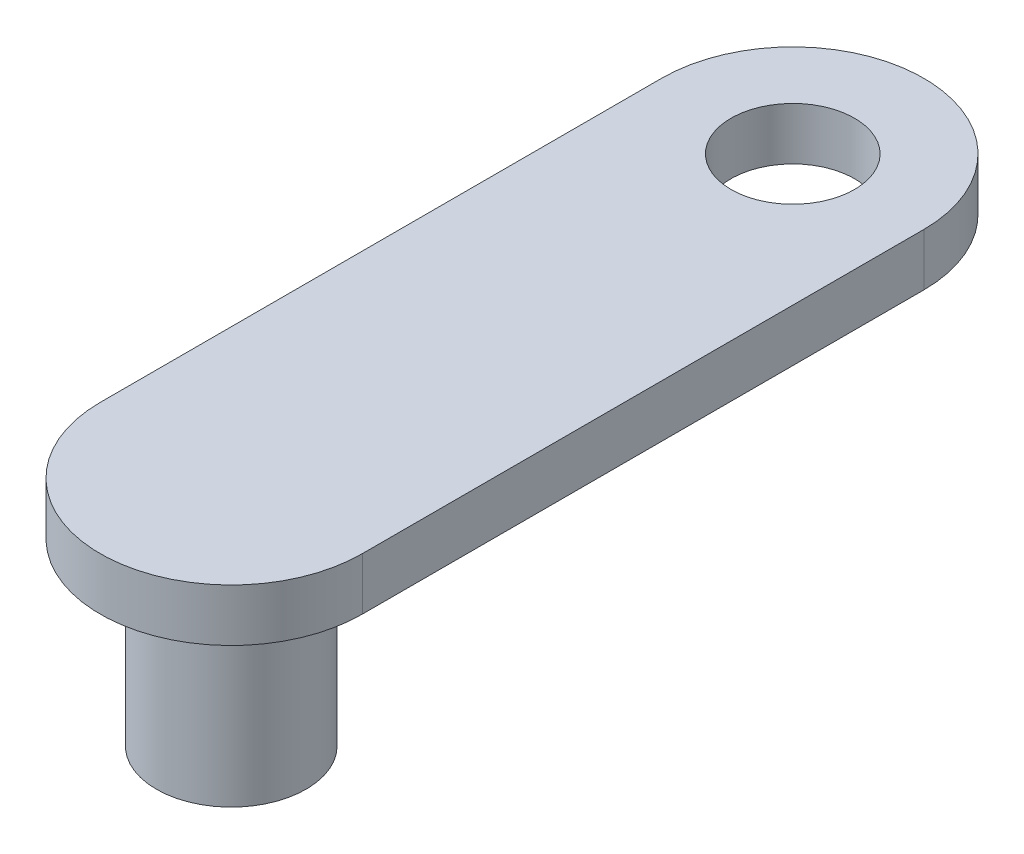
from build123d import *

# Parameters (mm, degrees)
SKETCH_1_R      = 2
EXTRUDE_1_DEPTH = 4.8
SKETCH_2_R      = 1.65
EXTRUDE_2_DEPTH = 1.4


with BuildPart() as part:
    # 草图1 → 凸台-拉伸1 (new body)
    with BuildSketch(Plane(origin=(0, 0, 0), x_dir=(1, 0, 0), z_dir=(0, 1, 0))):
        with Locations(Location((0, 0, 0), (0, 0, 270))):
            Circle(SKETCH_1_R)
    extrude(amount=EXTRUDE_1_DEPTH)

    # 草图2 → 凸台-拉伸2 (add)
    with BuildSketch(Plane(origin=(0, 4.8, 0), x_dir=(1, 0, 0), z_dir=(0, 1, 0))):
        with BuildLine():
            Line((-3.5, 0), (-3.5, 15))
            ThreePointArc((-3.5, 15), (0, 18.5), (3.5, 15))
            Line((3.5, 15), (3.5, 0))
            ThreePointArc((3.5, 0), (0, -3.5), (-3.5, 0))
        make_face()
        with Locations(Location((0, 15, 0), (0, 0, 270))):
            Circle(SKETCH_2_R, mode=Mode.SUBTRACT)
    extrude(amount=EXTRUDE_2_DEPTH)


solid = part.part
